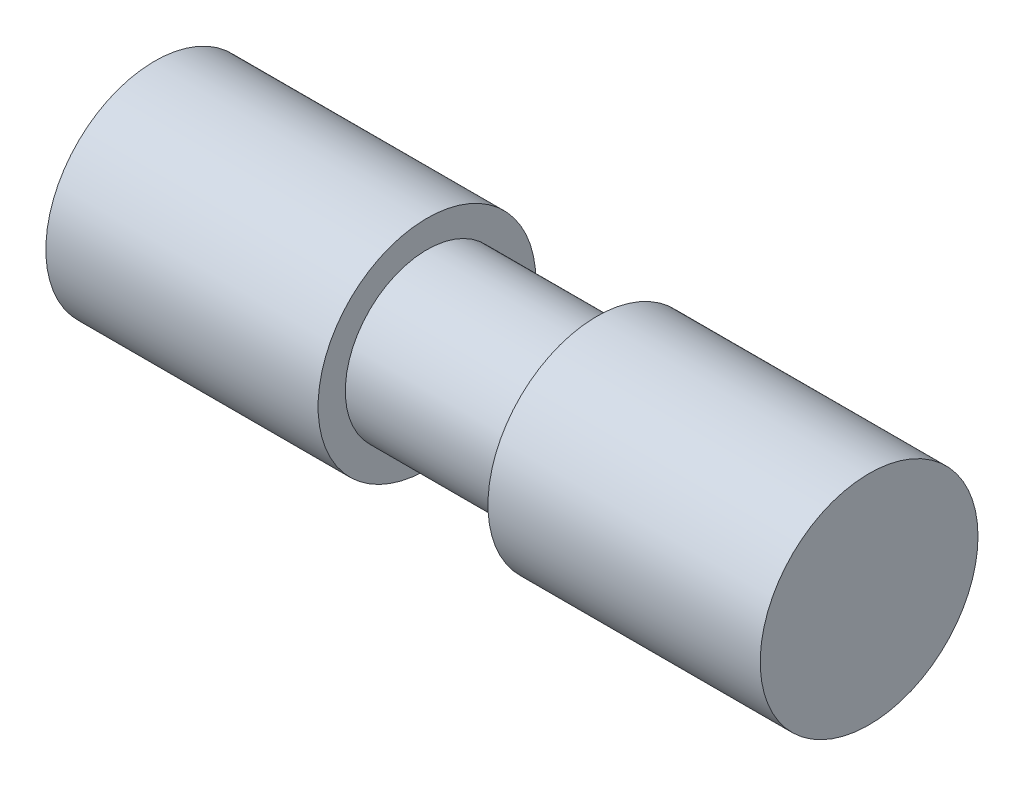
from build123d import *

# Parameters (mm, degrees)
SKETCH_1_R      = 40
EXTRUDE_1_DEPTH = 50
SKETCH_2_R      = 40
EXTRUDE_2_DEPTH = 50
SKETCH_3_R      = 30
EXTRUDE_3_DEPTH = 62.4


with BuildPart() as part:
    # 草图1 → 凸台-拉伸1 (new, symmetric)
    with BuildSketch(Plane(origin=(0, 0, 0), x_dir=(0, 0, -1), z_dir=(1, 0, 0))):
        Circle(SKETCH_1_R)
    extrude(amount=EXTRUDE_1_DEPTH, both=True)



with BuildPart() as body_2:
    # 草图2 → 凸台-拉伸2 (new, symmetric)
    with BuildSketch(Plane(origin=(-162.4, 0, 0), x_dir=(0, 0, -1), z_dir=(1, 0, 0))):
        Circle(SKETCH_2_R)
    extrude(amount=EXTRUDE_2_DEPTH, both=True)


with BuildPart() as part_1:
    add(part.part)

    add(body_2.part)  # 凸台-拉伸3 merges body 2
    # 草图3 → 凸台-拉伸3 (add)
    with BuildSketch(Plane(origin=(-112.4, 0, 0), x_dir=(0, 0, -1), z_dir=(1, 0, 0))):
        Circle(SKETCH_3_R)
    extrude(amount=EXTRUDE_3_DEPTH)


solid = part_1.part
